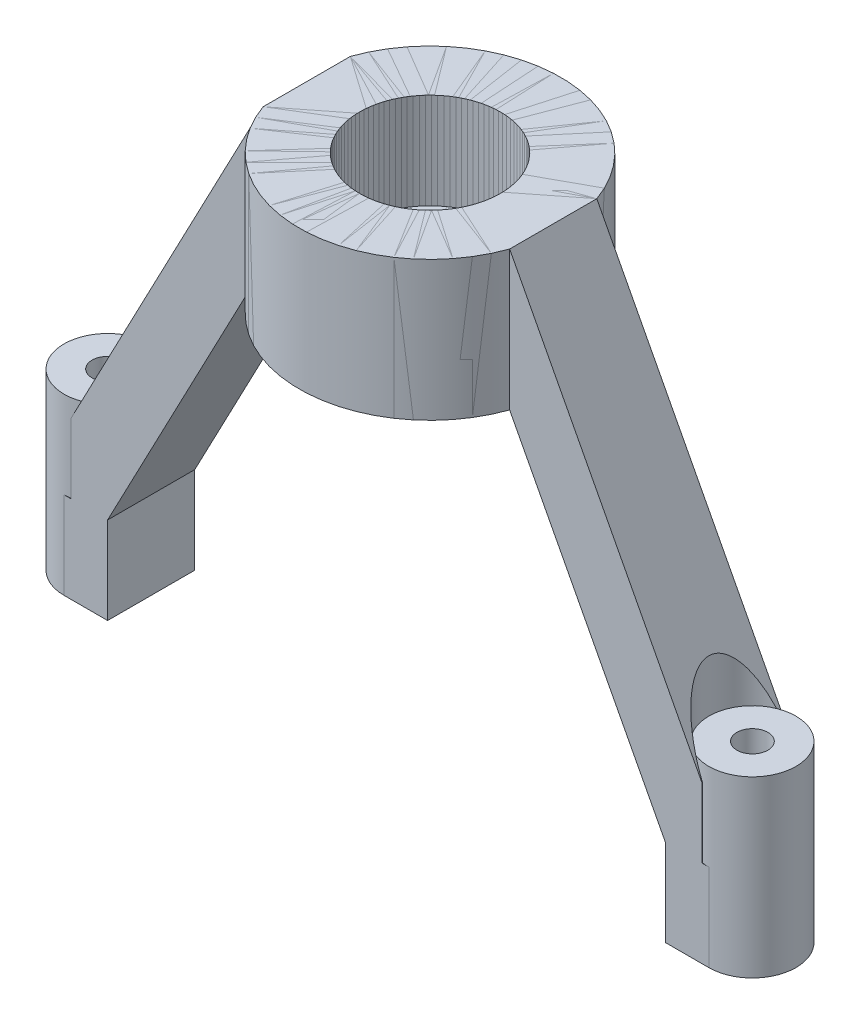
from build123d import *

# Parameters (mm, degrees)
SKETCH1_R                = 1.875
BOSS_EXTRUDE1_DEPTH      = 8
BOSS_EXTRUDE2_START      = -17
SKETCH1_3_R              = 2.5
SKETCH1_3_R_2            = 0.889
BOSS_EXTRUDE2_DEPTH      = 5
SKETCH4_R                = 4.05
CUT_EXTRUDE1_DEPTH       = 5.5
BOSS_EXTRUDE3_DEPTH      = 2.5
BOSS_EXTRUDE3_DEPTH_BACK = 2.5
SKETCH5_R                = 2.5
CUT_EXTRUDE2_DEPTH       = 30.954131602
BOSS_EXTRUDE4_START      = 5
SKETCH8_R                = 0.889
BOSS_EXTRUDE4_DEPTH      = 5
SKETCH1_4_R              = 0.889
CUT_EXTRUDE3_DEPTH       = 32.324910215
CIRPATTERN5_COUNT        = 2


with BuildPart() as part:
    # Sketch1 → Boss-Extrude1 (new body)
    with BuildSketch(Plane(origin=(0, 0, 0), x_dir=(1, 0, 0), z_dir=(0, 1, 0))):
        with BuildLine():
            Line((7.071067812, -2.5), (7.071067812, 2.5))
            ThreePointArc((7.071067812, 2.5), (0, 7.5), (-7.071067812, 2.5))
            Line((-7.071067812, 2.5), (-7.071067812, -2.5))
            ThreePointArc((-7.071067812, -2.5), (0, -7.5), (7.071067812, -2.5))
        make_face()
        Circle(SKETCH1_R, mode=Mode.SUBTRACT)
    extrude(amount=BOSS_EXTRUDE1_DEPTH)

    # Sketch4 → Cut-Extrude1 (cut)
    with BuildSketch(Plane(origin=(0, 8, 0), x_dir=(1, 0, 0), z_dir=(0, 1, 0))):
        Circle(SKETCH4_R)
    extrude(amount=-CUT_EXTRUDE1_DEPTH, mode=Mode.SUBTRACT)



with BuildPart() as body_2:
    # Sketch1<3> → Boss-Extrude2 (new body)
    with BuildSketch(Plane(origin=(0, 0, 0), x_dir=(1, 0, 0), z_dir=(0, 1, 0)).offset(BOSS_EXTRUDE2_START)):
        with Locations((-18.5, 0)):
            Circle(SKETCH1_3_R)
        with Locations((-18.5, 0)):
            Circle(SKETCH1_3_R_2, mode=Mode.SUBTRACT)
    extrude(amount=BOSS_EXTRUDE2_DEPTH)


with BuildPart() as part_1:
    add(part.part)

    add(body_2.part)  # Boss-Extrude3 merges body 2
    # Sketch3 → Boss-Extrude3 (add, two sides: drawn at the far end of the back side and taken through both)
    with BuildSketch(Plane.XY.offset(-BOSS_EXTRUDE3_DEPTH_BACK)):
        Polygon((-7.071067812, 8), (-18.098268146, -12.994941134), (-18.098268146, -17), (-16, -17), (-7.071067812, 0), align=None)
    extrude(amount=BOSS_EXTRUDE3_DEPTH + BOSS_EXTRUDE3_DEPTH_BACK)

    # Sketch5 → Cut-Extrude2 (cut, through all)
    with BuildSketch(Plane(origin=(0, -12, 0), x_dir=(1, 0, 0), z_dir=(0, 1, 0))):
        with Locations((-18.5, 0)):
            Circle(SKETCH5_R)
    extrude(amount=CUT_EXTRUDE2_DEPTH, mode=Mode.SUBTRACT)

    # Sketch8 → Boss-Extrude4 (add)
    with BuildSketch(Plane.XZ.offset(17).offset(BOSS_EXTRUDE4_START)):
        with BuildLine():
            Line((-18.5, -2.5), (-16, -2.5))
            Line((-16, -2.5), (-16, 2.5))
            Line((-16, 2.5), (-18.5, 2.5))
            ThreePointArc((-18.5, 2.5), (-21, 0), (-18.5, -2.5))
        make_face()
        with Locations((-18.5, 0)):
            Circle(SKETCH8_R, mode=Mode.SUBTRACT)
    extrude(amount=-BOSS_EXTRUDE4_DEPTH)

    # Sketch1<4> → Cut-Extrude3 (cut, through all)
    with BuildSketch(Plane(origin=(0, 0, 0), x_dir=(1, 0, 0), z_dir=(0, 1, 0))):
        with Locations((-18.5, 0)):
            Circle(SKETCH1_4_R)
    extrude(amount=-CUT_EXTRUDE3_DEPTH, mode=Mode.SUBTRACT)


with BuildPart() as cirpattern5_1:
    # CirPattern5: pattern copy
    add(part_1.part.rotate(Axis((0, 8, 0), (0, 1, 0)), 1 * 360 / CIRPATTERN5_COUNT))


solid = Compound([part_1.part, cirpattern5_1.part])
